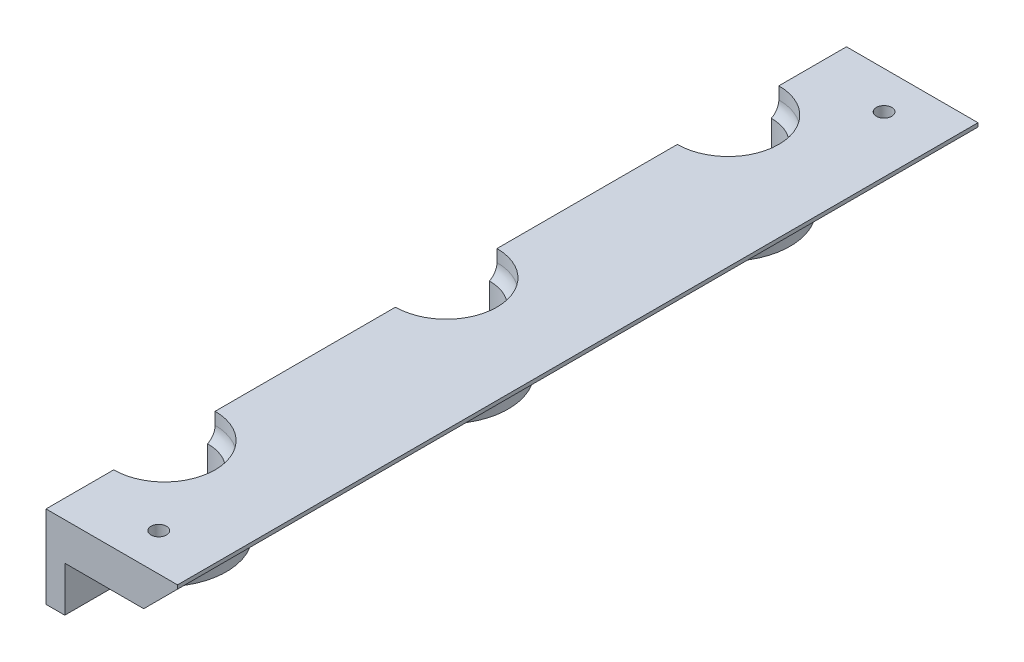
from build123d import *

# Parameters (mm, degrees)
BOSS_EXTRUDE1_DEPTH = 10
BOSS_EXTRUDE2_DEPTH = 12
SKETCH7_R           = 1.95
CUT_EXTRUDE3_DEPTH  = 4
SKETCH8_R           = 1.95
CUT_EXTRUDE4_DEPTH  = 4
SKETCH9_R           = 1.5
CUT_EXTRUDE5_DEPTH  = 4
LPATTERN1_COUNT     = 2
LPATTERN1_PITCH     = 75
CHAMFER1_SIZE       = 9
LPATTERN2_COUNT     = 3
LPATTERN2_PITCH     = 75
SKETCH12_R          = 2.05
CUT_EXTRUDE6_DEPTH  = 4
SKETCH13_R          = 1.6
CUT_EXTRUDE8_DEPTH  = 5


with BuildPart() as part:
    # Sketch1 → Boss-Extrude1 (new body)
    with BuildSketch(Plane(origin=(0, 0, 0), x_dir=(1, 0, 0), z_dir=(0, 1, 0))):
        with BuildLine():
            Line((0, -11.5), (0, -31.5))
            Line((0, -31.5), (35, -31.5))
            Line((35, -31.5), (35, 181.5))
            Line((35, 181.5), (0, 181.5))
            Line((0, 181.5), (0, 161.5))
            ThreePointArc((0, 161.5), (11.5, 150), (0, 138.5))
            Line((0, 138.5), (0, 86.5))
            ThreePointArc((0, 86.5), (11.5, 75), (0, 63.5))
            Line((0, 63.5), (0, 11.5))
            ThreePointArc((0, 11.5), (11.5, 0), (0, -11.5))
        make_face()
    extrude(amount=-BOSS_EXTRUDE1_DEPTH)

    # Sketch3 → Boss-Extrude2 (add)
    with BuildSketch(Plane.XZ.offset(10)):
        with BuildLine():
            Line((0, -181.5), (0, -161.5))
            ThreePointArc((0, -161.5), (11.5, -150), (0, -138.5))
            Line((0, -138.5), (0, -86.5))
            ThreePointArc((0, -86.5), (11.5, -75), (0, -63.5))
            Line((0, -63.5), (0, -11.5))
            ThreePointArc((0, -11.5), (11.5, 0), (0, 11.5))
            Line((0, 11.5), (0, 31.5))
            Line((0, 31.5), (5, 31.5))
            Line((5, 31.5), (5, 15.724185194))
            ThreePointArc((5, 15.724185194), (16.5, 0), (5, -15.724185194))
            Line((5, -15.724185194), (5, -59.275814806))
            ThreePointArc((5, -59.275814806), (16.5, -75), (5, -90.724185194))
            Line((5, -90.724185194), (5, -134.275814806))
            ThreePointArc((5, -134.275814806), (16.5, -150), (5, -165.724185194))
            Line((5, -165.724185194), (5, -181.5))
            Line((5, -181.5), (0, -181.5))
        make_face()
    extrude(amount=BOSS_EXTRUDE2_DEPTH)

    # Sketch7 → Cut-Extrude3 (cut)
    with BuildSketch(Plane.ZY):
        with Locations((-170.5, -4)):
            Circle(SKETCH7_R)
        with Locations(Location((-170.5, -18, 0), (0, 0, 180))):
            Circle(SKETCH7_R)
        with Locations(Location((-129.5, -4, 0), (0, 0, 180))):
            Circle(SKETCH7_R)
        with Locations((-129.5, -18)):
            Circle(SKETCH7_R)
        with Locations((-95.5, -4)):
            Circle(SKETCH7_R)
        with Locations(Location((-54.5, -4, 0), (0, 0, 180))):
            Circle(SKETCH7_R)
        with Locations((-54.5, -18)):
            Circle(SKETCH7_R)
        with Locations(Location((-95.5, -18, 0), (0, 0, 180))):
            Circle(SKETCH7_R)
        with Locations((-20.5, -4)):
            Circle(SKETCH7_R)
        with Locations(Location((20.5, -4, 0), (0, 0, 180))):
            Circle(SKETCH7_R)
        with Locations((20.5, -18)):
            Circle(SKETCH7_R)
        with Locations(Location((-20.5, -18, 0), (0, 0, 180))):
            Circle(SKETCH7_R)
    extrude(amount=-CUT_EXTRUDE3_DEPTH, mode=Mode.SUBTRACT)

    # Sketch8 → Cut-Extrude4 (cut)
    with BuildSketch(Plane.ZY):
        with Locations((-112.5, -18.5)):
            Circle(SKETCH8_R)
    cut_extrude4 = extrude(amount=-CUT_EXTRUDE4_DEPTH, mode=Mode.SUBTRACT)

    # Sketch9 → Cut-Extrude5 (cut)
    with BuildSketch(Plane.ZY.offset(-4)):
        with Locations((-112.5, -18.5)):
            Circle(SKETCH9_R)
    cut_extrude5 = extrude(amount=-CUT_EXTRUDE5_DEPTH, mode=Mode.SUBTRACT)

    # LPattern1: Cut-Extrude4, Cut-Extrude5 ×2
    with Locations(*[(0, 0, i * LPATTERN1_PITCH) for i in range(1, LPATTERN1_COUNT)]):
        add(cut_extrude4, mode=Mode.SUBTRACT)
        add(cut_extrude5, mode=Mode.SUBTRACT)

    # Chamfer1
    chamfer1_edges = [part.edges().sort_by_distance(p)[0] for p in [
        (35, -10, -75),
    ]]
    chamfer(chamfer1_edges, length=CHAMFER1_SIZE)

    # Sketch10 → Cut-Revolve1 (revolve, cut)
    with BuildSketch(Plane.ZY):
        with BuildLine():
            Line((-161.5, 0), (-161.5, -6.48))
            ThreePointArc((-161.5, -6.48), (-162.959732838, -5.143785702), (-163.5, -3.24))
            Line((-163.5, -3.24), (-163.5, 0))
            Line((-163.5, 0), (-161.5, 0))
        make_face()
    cut_revolve1 = revolve(axis=Axis((0, 19.009810116, -150), (0, -1, 0)), mode=Mode.SUBTRACT)

    # LPattern2: Cut-Revolve1 ×3
    with Locations(*[(0, 0, i * LPATTERN2_PITCH) for i in range(1, LPATTERN2_COUNT)]):
        add(cut_revolve1, mode=Mode.SUBTRACT)

    # Sketch12 → Cut-Extrude6 (cut)
    with BuildSketch(Plane(origin=(0, 0, 0), x_dir=(1, 0, 0), z_dir=(0, 1, 0))):
        with Locations(Location((20, -21.5, 0), (0, 0, 270))):
            Circle(SKETCH12_R)
    cut_extrude6 = extrude(amount=-CUT_EXTRUDE6_DEPTH, mode=Mode.SUBTRACT)

    # Sketch13 → Cut-Extrude8 (cut)
    with BuildSketch(Plane(origin=(0, -4, 0), x_dir=(1, 0, 0), z_dir=(0, 1, 0))):
        with Locations(Location((20, -21.5, 0), (0, 0, 270))):
            Circle(SKETCH13_R)
    cut_extrude8 = extrude(amount=-CUT_EXTRUDE8_DEPTH, mode=Mode.SUBTRACT)

    # Mirror2: Cut-Extrude6, Cut-Extrude8 across plane
    add(cut_extrude6.mirror(Plane.XY.offset(-75)), mode=Mode.SUBTRACT)
    add(cut_extrude8.mirror(Plane.XY.offset(-75)), mode=Mode.SUBTRACT)


solid = part.part
